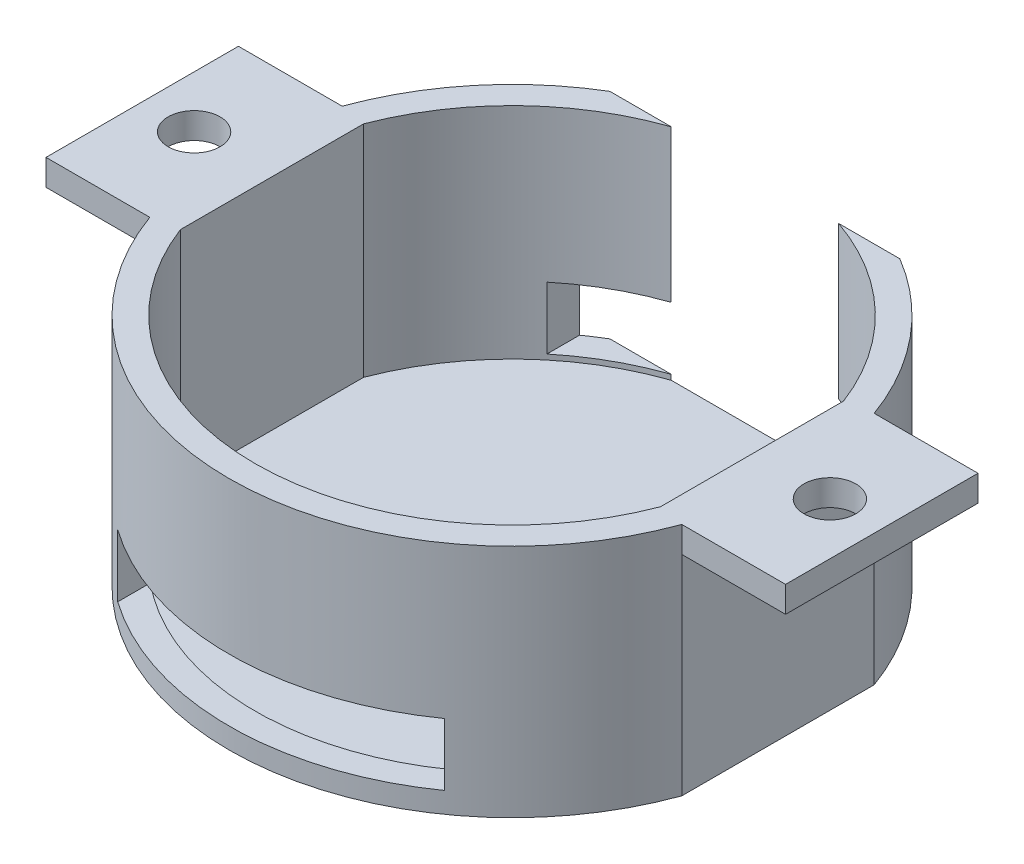
from build123d import *

# Parameters (mm, degrees)
EXTRUDE_1_DEPTH          = 42.3
EXTRUDE_START            = 3
EXTRUDE_2_DEPTH          = 3
SKETCH_3_W               = 37.077621282
SKETCH_3_H               = 5
EXTRUDE_4_DEPTH          = 20
SKETCH_5_W               = 37.077621282
SKETCH_5_H               = 5
EXTRUDE_5_DEPTH          = 20
CUT_EXTRUDE_1_REACH      = 102.493
SKETCH_6_R               = 5
CUT_EXTRUDE_2_REACH      = 102.493
SKETCH_7_R               = 5
CUT_EXTRUDE_3_DEPTH      = 137.919145849
CUT_EXTRUDE_3_DEPTH_BACK = 137.919145849
SKETCH_9_W               = 62.954996742
SKETCH_9_H               = 12
CUT_EXTRUDE_4_DEPTH      = 101.493295796
CUT_EXTRUDE_4_DEPTH_BACK = 101.493295796
CUT_EXTRUDE_5_DEPTH      = 101.493295796
CUT_EXTRUDE_5_DEPTH_BACK = 101.493295796
SKETCH_11_W              = 70.692803697
SKETCH_11_H              = 7.082333279


with BuildPart() as part:
    # 草图1 → 凸台-拉伸1 (new body)
    with BuildSketch(Plane(origin=(0, 0, 0), x_dir=(1, 0, 0), z_dir=(0, 1, 0))):
        with BuildLine():
            Line((-51.25, 18.538810641), (-51.25, -18.538810641))
            ThreePointArc((-51.25, -18.538810641), (0, -54.5), (51.25, -18.538810641))
            Line((51.25, -18.538810641), (51.25, 18.538810641))
            ThreePointArc((51.25, 18.538810641), (0, 54.5), (-51.25, 18.538810641))
        make_face()
        with BuildLine():
            Line((-46.25, 17.640507362), (-46.25, -17.640507362))
            ThreePointArc((-46.25, -17.640507362), (0, -49.5), (46.25, -17.640507362))
            Line((46.25, -17.640507362), (46.25, 17.640507362))
            ThreePointArc((46.25, 17.640507362), (0, 49.5), (-46.25, 17.640507362))
        make_face(mode=Mode.SUBTRACT)
    extrude(amount=EXTRUDE_1_DEPTH)

    # 草图2 → 凸台-拉伸2 (add)
    with BuildSketch(Plane(origin=(0, 0, 0), x_dir=(-1, 0, 0), z_dir=(0, -1, 0)).offset(EXTRUDE_START)):
        with BuildLine():
            Line((51.25, -18.538810641), (51.25, 18.538810641))
            ThreePointArc((51.25, 18.538810641), (0, 54.5), (-51.25, 18.538810641))
            Line((-51.25, 18.538810641), (-51.25, -18.538810641))
            ThreePointArc((-51.25, -18.538810641), (0, -54.5), (51.25, -18.538810641))
        make_face()
    extrude(amount=-EXTRUDE_2_DEPTH)

    # 草图3 → 凸台-拉伸4 (add)
    with BuildSketch(Plane.ZY.offset(51.25)):
        with Locations((0, 39.8)):
            Rectangle(SKETCH_3_W, SKETCH_3_H)
    extrude(amount=EXTRUDE_4_DEPTH)

    # 草图5 → 凸台-拉伸5 (add)
    with BuildSketch(Plane(origin=(51.25, 0, 0), x_dir=(0, 0, -1), z_dir=(1, 0, 0))):
        with Locations((0, 39.8)):
            Rectangle(SKETCH_5_W, SKETCH_5_H)
    extrude(amount=EXTRUDE_5_DEPTH)

    # 草图6 → 切除-拉伸1 (cut, up to next)
    with BuildSketch(Plane(origin=(0, 42.3, 0), x_dir=(1, 0, 0), z_dir=(0, 1, 0)), mode=Mode.PRIVATE) as cut_extrude_1_sk1:
        with Locations(Location((-61.25, 0, 0), (0, 0, 270))):
            Circle(SKETCH_6_R)
    cut_extrude_1_tool1 = extrude(cut_extrude_1_sk1.sketch, amount=-CUT_EXTRUDE_1_REACH, mode=Mode.PRIVATE) & part.part
    add(cut_extrude_1_tool1.solids().sort_by_distance((-61.25, 42.3, 0))[0], mode=Mode.SUBTRACT)

    # 草图7 → 切除-拉伸2 (cut, up to next)
    with BuildSketch(Plane(origin=(0, 42.3, 0), x_dir=(1, 0, 0), z_dir=(0, 1, 0)), mode=Mode.PRIVATE) as cut_extrude_2_sk1:
        with Locations(Location((61.25, 0, 0), (0, 0, 270))):
            Circle(SKETCH_7_R)
    cut_extrude_2_tool1 = extrude(cut_extrude_2_sk1.sketch, amount=-CUT_EXTRUDE_2_REACH, mode=Mode.PRIVATE) & part.part
    add(cut_extrude_2_tool1.solids().sort_by_distance((61.25, 42.3, 0))[0], mode=Mode.SUBTRACT)

    # 草图9 → 切除-拉伸3 (cut, two sides: drawn at the far end of the back side and taken through both)
    with BuildSketch(Plane(origin=(0, 0, -54.5), x_dir=(-1, 0, 0), z_dir=(0, 0, -1)).offset(-CUT_EXTRUDE_3_DEPTH_BACK)):
        with Locations((0, 7)):
            Rectangle(SKETCH_9_W, SKETCH_9_H)
    extrude(amount=CUT_EXTRUDE_3_DEPTH + CUT_EXTRUDE_3_DEPTH_BACK, mode=Mode.SUBTRACT)

    # 草图10 → 切除-拉伸4 (cut, two sides: drawn at the far end of the back side and taken through both)
    with BuildSketch(Plane.XZ.offset(3).offset(-CUT_EXTRUDE_4_DEPTH_BACK)):
        with BuildLine():
            Line((21.685248442, -50), (-21.685248442, -50))
            ThreePointArc((-21.685248442, -50), (-11.073617375, -53.363142694), (-1.63e-07, -54.5))
            ThreePointArc((-1.63e-07, -54.5), (11.073617215, -53.363142728), (21.685248442, -50))
        make_face()
    extrude(amount=CUT_EXTRUDE_4_DEPTH + CUT_EXTRUDE_4_DEPTH_BACK, mode=Mode.SUBTRACT)

    # 草图11 → 切除-拉伸5 (cut, two sides: drawn at the far end of the back side and taken through both)
    with BuildSketch(Plane.XZ.offset(3).offset(-CUT_EXTRUDE_5_DEPTH_BACK)):
        with Locations((7.420622122, -50.342884842)):
            Rectangle(SKETCH_11_W, SKETCH_11_H)
    extrude(amount=CUT_EXTRUDE_5_DEPTH + CUT_EXTRUDE_5_DEPTH_BACK, mode=Mode.SUBTRACT)


solid = part.part
